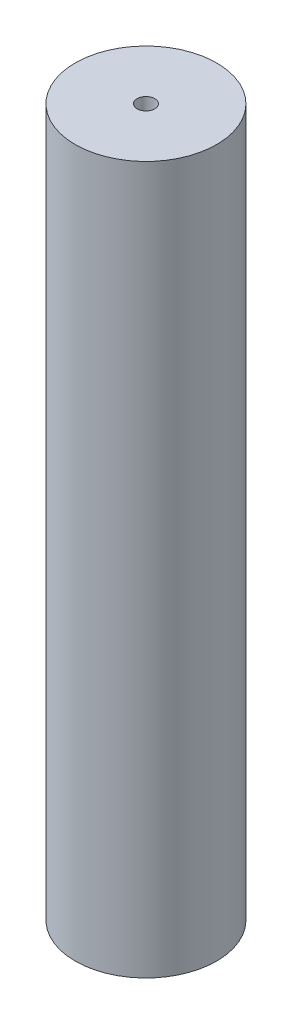
from build123d import *

# Parameters (mm, degrees)
SKETCH_1_R          = 20
EXTRUDE_1_DEPTH     = 200
SKETCH_2_R          = 2.5
CUT_EXTRUDE_1_DEPTH = 22


with BuildPart() as part:
    # 草图1 → 凸台-拉伸1 (new body)
    with BuildSketch(Plane(origin=(0, 0, 0), x_dir=(1, 0, 0), z_dir=(0, 1, 0))):
        with Locations(Location((0, 0, 0), (0, 0, 270))):
            Circle(SKETCH_1_R)
    extrude(amount=EXTRUDE_1_DEPTH)

    # 草图2 → 切除-拉伸1 (cut)
    with BuildSketch(Plane(origin=(0, 200, 0), x_dir=(1, 0, 0), z_dir=(0, 1, 0))):
        with Locations(Location((0, 0, 0), (0, 0, 270))):
            Circle(SKETCH_2_R)
    extrude(amount=-CUT_EXTRUDE_1_DEPTH, mode=Mode.SUBTRACT)


solid = part.part
